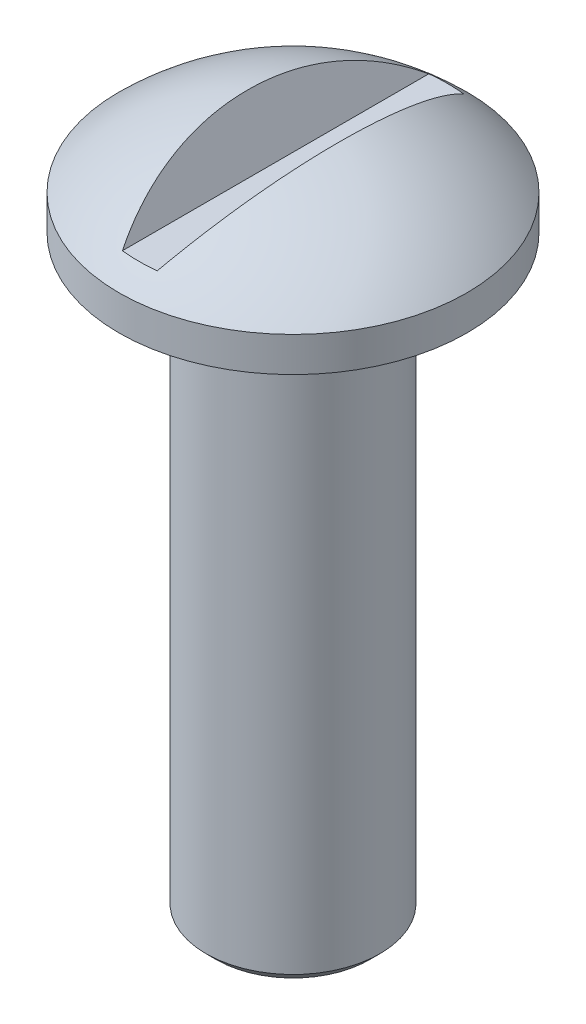
from build123d import *

# Parameters (mm, degrees)
SKETCH1_R           = 6.35
BOSS_EXTRUDE1_DEPTH = 43.18
SKETCH1_3_R         = 12.7
BOSS_EXTRUDE2_DEPTH = 7.62
SKETCH4_W           = 2.54
SKETCH4_H           = 33.82833048
CUT_EXTRUDE1_DEPTH  = 51.305467944
CUT_EXTRUDE1_TAPER  = -30
CHAMFER1_SIZE       = 0.762


with BuildPart() as part:
    # Sketch1 → Boss-Extrude1 (new body)
    with BuildSketch(Plane(origin=(0, 0, 0), x_dir=(1, 0, 0), z_dir=(0, 1, 0))):
        with Locations(Location((0, 0, 0), (0, 0, 270))):
            Circle(SKETCH1_R)
    extrude(amount=-BOSS_EXTRUDE1_DEPTH)

    # Sketch1<3> → Boss-Extrude2 (add)
    with BuildSketch(Plane(origin=(0, 0, 0), x_dir=(1, 0, 0), z_dir=(0, 1, 0))):
        with Locations(Location((0, 0, 0), (0, 0, 270))):
            Circle(SKETCH1_3_R)
    extrude(amount=BOSS_EXTRUDE2_DEPTH)

    # Sketch3 → Cut-Revolve1 (revolve, cut)
    with BuildSketch(Plane.XY, mode=Mode.PRIVATE) as cut_revolve1_sk:
        with BuildLine():
            Line((-12.7, 2.54), (-15.209374463, 2.54))
            Line((-15.209374463, 2.54), (-15.209374463, 10.331344658))
            Line((-15.209374463, 10.331344658), (0, 10.331344658))
            Line((0, 10.331344658), (0, 7.62))
            ThreePointArc((0, 7.62), (-6.858056154, 6.350140386), (-12.7, 2.54))
        make_face()
    revolve(cut_revolve1_sk.sketch.rotate(Axis((0, 0, 0), (0, 1, 0)), 270), axis=Axis((0, 0, 0), (0, 1, 0)), mode=Mode.SUBTRACT)

    # Sketch4 → Cut-Extrude1 (cut, through all)
    with BuildSketch(Plane(origin=(0, 3.81, 0), x_dir=(1, 0, 0), z_dir=(0, 1, 0))):
        Rectangle(SKETCH4_W, SKETCH4_H)
    extrude(amount=CUT_EXTRUDE1_DEPTH, taper=CUT_EXTRUDE1_TAPER, mode=Mode.SUBTRACT)

    # Chamfer1
    chamfer1_edges = [part.edges().sort_by_distance(p)[0] for p in [
        (0, -43.18, -6.35),
    ]]
    chamfer(chamfer1_edges, length=CHAMFER1_SIZE)


solid = part.part
